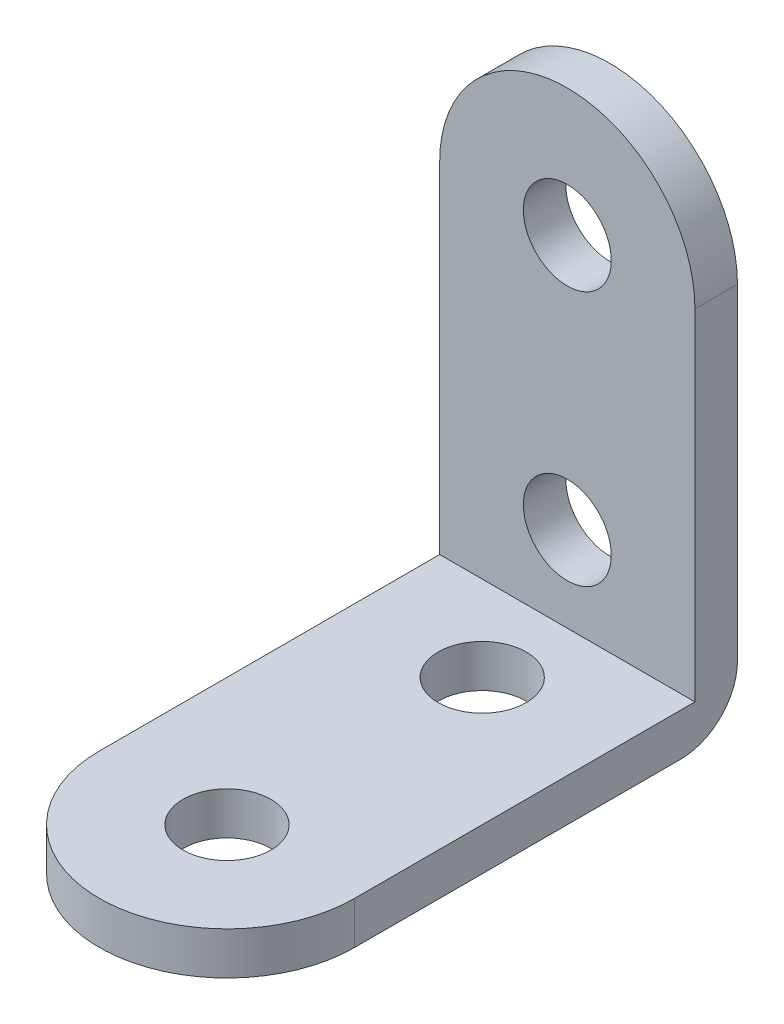
from build123d import *

# Parameters (mm, degrees)
CROQUIS1_R              = 4.5
CROQUIS1_R_2            = 1.55
SALIENTE_EXTRUIR1_DEPTH = 1.5
CROQUIS6_R              = 1.55
CORTAR_EXTRUIR1_DEPTH   = 1.5
REDONDEO1_R             = 2


with BuildPart() as part:
    # Croquis1 → Saliente-Extruir1 (new body)
    # profile 1 of 2: a face of its own
    with BuildSketch(Plane(origin=(0, 0, 0), x_dir=(1, 0, 0), z_dir=(0, 1, 0))):
        with BuildLine():
            Line((-4.5, 13.5), (-4.5, 0))
            ThreePointArc((-4.5, 0), (0, 4.5), (4.5, 0))
            Line((4.5, 0), (4.5, 13.5))
            Line((4.5, 13.5), (-4.5, 13.5))
        make_face()
    # profile 2 of 2: a face of its own
    with BuildSketch(Plane(origin=(0, 0, 0), x_dir=(1, 0, 0), z_dir=(0, 1, 0))):
        Circle(CROQUIS1_R)
        with Locations(Location((0, 0, 0), (0, 0, 270))):
            Circle(CROQUIS1_R_2, mode=Mode.SUBTRACT)
    saliente_extruir1 = extrude(amount=SALIENTE_EXTRUIR1_DEPTH)

    # Croquis6 → Cortar-Extruir1 (cut)
    with BuildSketch(Plane(origin=(0, 1.5, 0), x_dir=(1, 0, 0), z_dir=(0, 1, 0))):
        with Locations(Location((0, 9, 0), (0, 0, 270))):
            Circle(CROQUIS6_R)
    cortar_extruir1 = extrude(amount=-CORTAR_EXTRUIR1_DEPTH, mode=Mode.SUBTRACT)

    # Simetría1: Saliente-Extruir1, Cortar-Extruir1 across plane
    add(saliente_extruir1.mirror(Plane(origin=(0, 6.75, -6.75), x_dir=(0, 0.7071067811865479, 0.7071067811865472), z_dir=(0, 0.7071067811865474, -0.7071067811865478))))
    add(cortar_extruir1.mirror(Plane(origin=(0, 6.75, -6.75), x_dir=(0, 0.7071067811865479, 0.7071067811865472), z_dir=(0, 0.7071067811865474, -0.7071067811865478))), mode=Mode.SUBTRACT)

    # Redondeo1
    redondeo1_edges = [part.edges().sort_by_distance(p)[0] for p in [
        (0, 0, -13.5),
    ]]
    fillet(redondeo1_edges, radius=REDONDEO1_R)


solid = part.part
